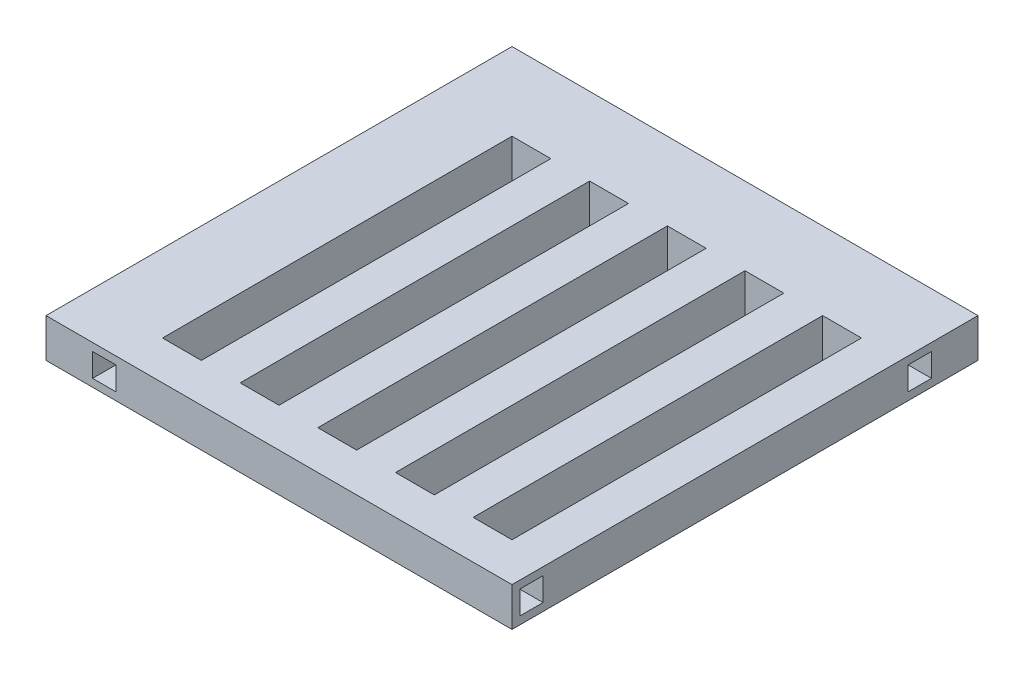
from build123d import *

# Parameters (mm, degrees)
SKETCH3_W           = 152.4
SKETCH3_H           = 152.4
BOSS_EXTRUDE1_DEPTH = 12.7
SKETCH5_W           = 147.32
SKETCH5_H           = 7.62
CUT_EXTRUDE1_DEPTH  = 12.7
SKETCH6_W           = 12.7
SKETCH6_H           = 127
CUT_EXTRUDE3_DEPTH  = 12.7
SKETCH8_W           = 7.62
SKETCH8_H           = 7.62
CUT_EXTRUDE4_DEPTH  = 25.4
SKETCH9_W           = 7.62
SKETCH9_H           = 7.62
CUT_EXTRUDE5_DEPTH  = 25.4
SKETCH10_W          = 7.508888552
SKETCH10_H          = 7.62
CUT_EXTRUDE6_DEPTH  = 25.4
SKETCH11_W          = 7.62
SKETCH11_H          = 7.62
BOSS_EXTRUDE2_DEPTH = 25.4
SKETCH12_W          = 127.135461675
SKETCH12_H          = 12.7
BOSS_EXTRUDE3_DEPTH = 25.4
SKETCH14_W          = 121.92
SKETCH14_H          = 7.62
CUT_EXTRUDE7_DEPTH  = 12.7
SKETCH15_W          = 7.62
SKETCH15_H          = 7.62
CUT_EXTRUDE9_DEPTH  = 25.4


with BuildPart() as part:
    # Sketch3 → Boss-Extrude1 (new body)
    with BuildSketch(Plane(origin=(0, 0, 0), x_dir=(1, 0, 0), z_dir=(0, 1, 0))):
        with Locations((-76.2, 76.2)):
            Rectangle(SKETCH3_W, SKETCH3_H)
    extrude(amount=BOSS_EXTRUDE1_DEPTH)

    # Sketch5 → Cut-Extrude1 (cut)
    with BuildSketch(Plane.ZY.offset(152.4)):
        with Locations((-76.2, 6.35)):
            Rectangle(SKETCH5_W, SKETCH5_H)
    extrude(amount=-CUT_EXTRUDE1_DEPTH, mode=Mode.SUBTRACT)

    # Sketch6 → Cut-Extrude3 (cut)
    with BuildSketch(Plane(origin=(0, 12.7, 0), x_dir=(1, 0, 0), z_dir=(0, 1, 0))):
        with Locations((-120.65, 76.2)):
            Rectangle(SKETCH6_W, SKETCH6_H)
        with Locations((-95.25, 76.2)):
            Rectangle(SKETCH6_W, SKETCH6_H)
        with Locations((-69.85, 76.2)):
            Rectangle(SKETCH6_W, SKETCH6_H)
        with Locations((-44.45, 76.2)):
            Rectangle(SKETCH6_W, SKETCH6_H)
        with Locations((-19.05, 76.2)):
            Rectangle(SKETCH6_W, SKETCH6_H)
    extrude(amount=-CUT_EXTRUDE3_DEPTH, mode=Mode.SUBTRACT)

    # Sketch8 → Cut-Extrude4 (cut)
    with BuildSketch(Plane(origin=(0, 0, 0), x_dir=(0, 0, -1), z_dir=(1, 0, 0))):
        with Locations((146.05, 6.35)):
            Rectangle(SKETCH8_W, SKETCH8_H)
        with Locations((6.35, 6.35)):
            Rectangle(SKETCH8_W, SKETCH8_H)
    extrude(amount=-CUT_EXTRUDE4_DEPTH, mode=Mode.SUBTRACT)

    # Sketch9 → Cut-Extrude5 (cut)
    with BuildSketch(Plane.XY):
        with Locations((-133.35, 6.35)):
            Rectangle(SKETCH9_W, SKETCH9_H)
    extrude(amount=-CUT_EXTRUDE5_DEPTH, mode=Mode.SUBTRACT)

    # Sketch10 → Cut-Extrude6 (cut)
    with BuildSketch(Plane(origin=(0, 0, -152.4), x_dir=(-1, 0, 0), z_dir=(0, 0, -1))):
        with Locations((133.405555724, 6.35)):
            Rectangle(SKETCH10_W, SKETCH10_H)
    extrude(amount=-CUT_EXTRUDE6_DEPTH, mode=Mode.SUBTRACT)

    # Sketch11 → Boss-Extrude2 (add)
    with BuildSketch(Plane(origin=(-25.4, 0, 0), x_dir=(0, 0, -1), z_dir=(1, 0, 0))):
        with Locations((146.05, 6.35)):
            Rectangle(SKETCH11_W, SKETCH11_H)
    extrude(amount=BOSS_EXTRUDE2_DEPTH)

    # Sketch12 → Boss-Extrude3 (add)
    with BuildSketch(Plane(origin=(0, 0, -152.4), x_dir=(-1, 0, 0), z_dir=(0, 0, -1))):
        with Locations((63.567730838, 6.35)):
            Rectangle(SKETCH12_W, SKETCH12_H)
    extrude(amount=-BOSS_EXTRUDE3_DEPTH)

    # Sketch14 → Cut-Extrude7 (cut)
    with BuildSketch(Plane(origin=(0, 0, -152.4), x_dir=(-1, 0, 0), z_dir=(0, 0, -1))):
        with Locations((63.5, 6.35)):
            Rectangle(SKETCH14_W, SKETCH14_H)
    extrude(amount=-CUT_EXTRUDE7_DEPTH, mode=Mode.SUBTRACT)

    # Sketch15 → Cut-Extrude9 (cut)
    with BuildSketch(Plane(origin=(0, 0, 0), x_dir=(0, 0, -1), z_dir=(1, 0, 0))):
        with Locations((133.35, 6.35)):
            Rectangle(SKETCH15_W, SKETCH15_H)
    extrude(amount=-CUT_EXTRUDE9_DEPTH, mode=Mode.SUBTRACT)


solid = part.part
